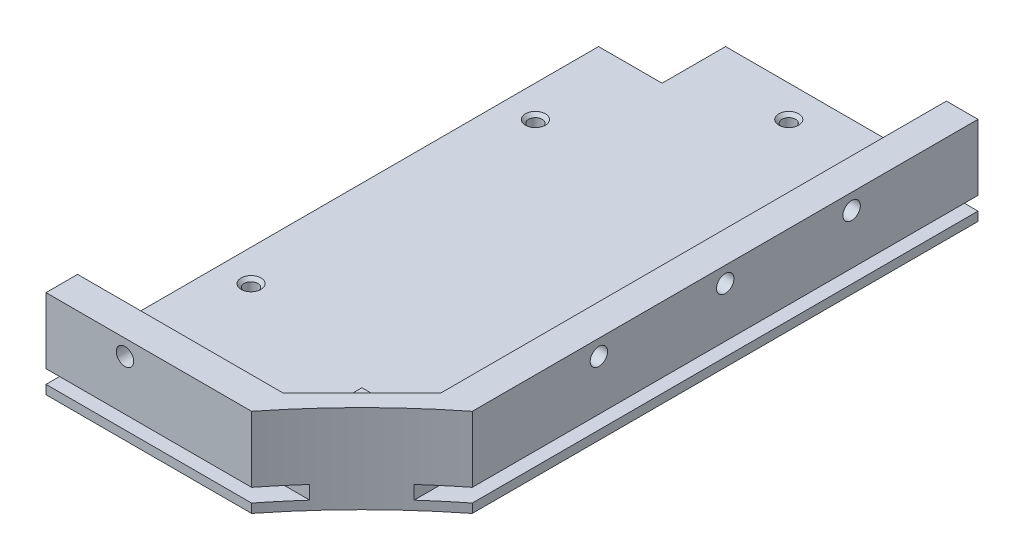
from build123d import *

# Parameters (mm, degrees)
SKETCH1_W                = 650
SKETCH1_H                = 650
BOSS_EXTRUDE1_DEPTH      = 8
BOSS_EXTRUDE2_DEPTH      = 650
CUT_EXTRUDE2_DEPTH       = 921.277302922
CUT_EXTRUDE2_DEPTH_BACK  = 921.277302922
SKETCH4_R                = 11
CUT_EXTRUDE1_DEPTH       = 920.932062709
CUT_EXTRUDE1_DEPTH_BACK  = 920.932062709
SKETCH2_R                = 210
CUT_EXTRUDE3_DEPTH       = 921.277302998
CUT_EXTRUDE3_DEPTH_BACK  = 110
CUT_EXTRUDE4_DEPTH       = 110
CUT_EXTRUDE5_DEPTH       = 920.932062713
CUT_EXTRUDE5_DEPTH_BACK  = 920.932062713
SKETCH7_OUTSIDE_W        = 836.056
SKETCH7_OUTSIDE_H        = 836.056
BOSS_EXTRUDE3_DEPTH      = 160.08
BOSS_EXTRUDE4_DEPTH      = 160.08
SKETCH21_W               = 10
SKETCH21_H               = 4.3
CUT_EXTRUDE10_DEPTH      = 680.197320372
SKETCH22_W               = 10
SKETCH22_H               = 4.3
CUT_EXTRUDE11_DEPTH      = 278.189465889
BOSS_EXTRUDE5_DEPTH      = 60
CUT_EXTRUDE6_DEPTH       = 679.914574891
CUT_EXTRUDE6_DEPTH_BACK  = 679.914574891
SKETCH12_R               = 210
CUT_EXTRUDE14_DEPTH      = 11
SKETCH27_R               = 2.75
CUT_EXTRUDE15_DEPTH      = 11
SKETCH28_R               = 2.75
SKETCH28_R_2             = 2.2
CUT_EXTRUDE16_DEPTH      = 11
SKETCH29_W               = 20
SKETCH29_H               = 20
CUT_EXTRUDE17_DEPTH      = 10
CUT_EXTRUDE18_DEPTH      = 679.914574891
CUT_EXTRUDE18_DEPTH_BACK = 679.914574891
SKETCH30_W               = 95
SKETCH30_H               = 195
CUT_EXTRUDE19_DEPTH      = 679.914574891
CUT_EXTRUDE19_DEPTH_BACK = 679.914574891
SKETCH31_W               = 20.1
SKETCH31_H               = 20.1
SKETCH32_R               = 2.15
CUT_EXTRUDE20_DEPTH      = 10
CHAMFER1_SIZE            = 1


with BuildPart() as part:
    # Sketch1 → Boss-Extrude1 (new body)
    with BuildSketch(Plane(origin=(0, 0, 0), x_dir=(1, 0, 0), z_dir=(0, 1, 0))):
        with Locations((325, 325)):
            Rectangle(SKETCH1_W, SKETCH1_H)
    extrude(amount=BOSS_EXTRUDE1_DEPTH)

    # Sketch3 → Boss-Extrude2 (add)
    with BuildSketch(Plane.XY):
        Polygon((300, 43.707142143), (350, 43.707142143), (385, 8), (265, 8), align=None)
    extrude(amount=-BOSS_EXTRUDE2_DEPTH)

    # Sketch4 → Cut-Extrude2 (cut, two sides: drawn at the far end of the back side and taken through both)
    with BuildSketch(Plane.XY.offset(-CUT_EXTRUDE2_DEPTH_BACK)):
        with Locations((325, 22)):
            Circle(SKETCH4_R)
    extrude(amount=CUT_EXTRUDE2_DEPTH + CUT_EXTRUDE2_DEPTH_BACK, mode=Mode.SUBTRACT)

    # Sketch2 → Cut-Extrude1 (cut, two sides: drawn at the far end of the back side and taken through both)
    with BuildSketch(Plane(origin=(0, 8, 0), x_dir=(1, 0, 0), z_dir=(0, 1, 0)).offset(-CUT_EXTRUDE1_DEPTH_BACK)):
        with Locations(Location((325, 325, 0), (0, 0, 270))):
            Circle(SKETCH2_R)
    extrude(amount=CUT_EXTRUDE1_DEPTH + CUT_EXTRUDE1_DEPTH_BACK, mode=Mode.SUBTRACT)

    # Sketch5 → Cut-Extrude3 (cut, two sides: drawn at the far end of the back side and taken through both)
    with BuildSketch(Plane.XY.offset(-CUT_EXTRUDE3_DEPTH_BACK)):
        Polygon((300, 43.707142143), (350, 43.707142143), (365.396078824, 28), (350, 28), (350, 8), (300, 8), (300, 28), (284.603921176, 28), align=None)
    extrude(amount=CUT_EXTRUDE3_DEPTH + CUT_EXTRUDE3_DEPTH_BACK, mode=Mode.SUBTRACT)

    # Sketch6 → Cut-Extrude4 (cut)
    with BuildSketch(Plane(origin=(0, 0, -650), x_dir=(-1, 0, 0), z_dir=(0, 0, -1))):
        Polygon((-350, 43.707142143), (-300, 43.707142143), (-284.603921176, 28), (-300, 28), (-300, 8), (-350, 8), (-350, 28), (-365.396078824, 28), align=None)
    extrude(amount=-CUT_EXTRUDE4_DEPTH, mode=Mode.SUBTRACT)

    # Sketch7 outside → Cut-Extrude5 (cut, two sides: drawn at the far end of the back side and taken through both)
    with BuildSketch(Plane(origin=(0, 8, 0), x_dir=(1, 0, 0), z_dir=(0, 1, 0)).offset(-CUT_EXTRUDE5_DEPTH_BACK)):
        with Locations((325, 325)):
            Rectangle(SKETCH7_OUTSIDE_W, SKETCH7_OUTSIDE_H)
        Polygon((195, 455), (195, 489.924225025), (195, 650), (167.478198198, 686.544504505), (-70.838918919, 686.544504505), (-70.838918919, 472.462112512), (0, 455), (160.075774975, 455), align=None, mode=Mode.SUBTRACT)
    extrude(amount=CUT_EXTRUDE5_DEPTH + CUT_EXTRUDE5_DEPTH_BACK, mode=Mode.SUBTRACT)

    # Sketch8 → Boss-Extrude3 (add)
    with BuildSketch(Plane(origin=(0, 0, -650), x_dir=(-1, 0, 0), z_dir=(0, 0, -1))):
        Polygon((-195, 8), (-195, 28), (-185, 28), (-185, 17), (-175, 8), align=None)
    extrude(amount=-BOSS_EXTRUDE3_DEPTH)

    # Sketch10 → Boss-Extrude4 (add)
    with BuildSketch(Plane.ZY):
        Polygon((-455, 8), (-455, 28), (-465, 28), (-465, 17), (-475, 8), align=None)
    extrude(amount=-BOSS_EXTRUDE4_DEPTH)

    # Sketch21 → Cut-Extrude10 (cut, through all)
    with BuildSketch(Plane.ZY):
        with Locations((-460, 5)):
            Rectangle(SKETCH21_W, SKETCH21_H)
    extrude(amount=-CUT_EXTRUDE10_DEPTH, mode=Mode.SUBTRACT)

    # Sketch22 → Cut-Extrude11 (cut, through all)
    with BuildSketch(Plane(origin=(0, 0, -650), x_dir=(-1, 0, 0), z_dir=(0, 0, -1))):
        with Locations((-190, 5)):
            Rectangle(SKETCH22_W, SKETCH22_H)
    extrude(amount=-CUT_EXTRUDE11_DEPTH, mode=Mode.SUBTRACT)

    # Sketch23 → Boss-Extrude5 (add)
    with BuildSketch(Plane.XY.offset(-489.92)):
        Polygon((194.99464011, 8), (195, 28), (160.08, 28), (160.08, 8), align=None)
    extrude(amount=BOSS_EXTRUDE5_DEPTH)

    # Sketch12 → Cut-Extrude6 (cut, two sides: drawn at the far end of the back side and taken through both)
    with BuildSketch(Plane(origin=(0, 8, 0), x_dir=(1, 0, 0), z_dir=(0, 1, 0)).offset(-CUT_EXTRUDE6_DEPTH_BACK)):
        with Locations((325, 325)):
            Circle(SKETCH12_R)
    extrude(amount=CUT_EXTRUDE6_DEPTH + CUT_EXTRUDE6_DEPTH_BACK, mode=Mode.SUBTRACT)

    # Sketch26 → Cut-Extrude14 (cut)
    with BuildSketch(Plane(origin=(0, 28, 0), x_dir=(1, 0, 0), z_dir=(0, 1, 0))):
        Polygon((185, 489.92), (160.08, 489.92), (160.08, 465), align=None)
    extrude(amount=-CUT_EXTRUDE14_DEPTH, mode=Mode.SUBTRACT)

    # Sketch27 → Cut-Extrude15 (cut)
    with BuildSketch(Plane.ZY.offset(-185)):
        with Locations((-610, 23)):
            Circle(SKETCH27_R)
        with Locations((-570, 23)):
            Circle(SKETCH27_R)
        with Locations((-530, 23)):
            Circle(SKETCH27_R)
    extrude(amount=-CUT_EXTRUDE15_DEPTH, mode=Mode.SUBTRACT)

    # Sketch28 → Cut-Extrude16 (cut)
    with BuildSketch(Plane(origin=(0, 0, -465), x_dir=(-1, 0, 0), z_dir=(0, 0, -1))):
        with Locations((-120, 23)):
            Circle(SKETCH28_R)
        with Locations((-80, 23)):
            Circle(SKETCH28_R_2)
        with Locations((-40, 23)):
            Circle(SKETCH28_R_2)
    extrude(amount=-CUT_EXTRUDE16_DEPTH, mode=Mode.SUBTRACT)

    # Sketch29 → Cut-Extrude17 (cut)
    with BuildSketch(Plane(origin=(0, 8, 0), x_dir=(1, 0, 0), z_dir=(0, 1, 0))):
        with Locations((10, 640)):
            Rectangle(SKETCH29_W, SKETCH29_H)
    extrude(amount=-CUT_EXTRUDE17_DEPTH, mode=Mode.SUBTRACT)

    # Sketch30 → Cut-Extrude18 (cut, two sides: drawn at the far end of the back side and taken through both)
    with BuildSketch(Plane(origin=(0, 8, 0), x_dir=(1, 0, 0), z_dir=(0, 1, 0)).offset(-CUT_EXTRUDE18_DEPTH_BACK)):
        with Locations((47.5, 552.5)):
            Rectangle(SKETCH30_W, SKETCH30_H)
    extrude(amount=CUT_EXTRUDE18_DEPTH + CUT_EXTRUDE18_DEPTH_BACK, mode=Mode.SUBTRACT)

    # Sketch31 → Cut-Extrude19 (cut, two sides: drawn at the far end of the back side and taken through both)
    with BuildSketch(Plane(origin=(0, 8, 0), x_dir=(1, 0, 0), z_dir=(0, 1, 0)).offset(-CUT_EXTRUDE19_DEPTH_BACK)):
        with Locations((105.05, 639.95)):
            Rectangle(SKETCH31_W, SKETCH31_H)
    extrude(amount=CUT_EXTRUDE19_DEPTH + CUT_EXTRUDE19_DEPTH_BACK, mode=Mode.SUBTRACT)

    # Sketch32 → Cut-Extrude20 (cut)
    with BuildSketch(Plane(origin=(0, 8, 0), x_dir=(1, 0, 0), z_dir=(0, 1, 0))):
        with Locations(Location((105, 599.9, 0), (0, 0, 270))):
            Circle(SKETCH32_R)
        with Locations(Location((105, 509.9, 0), (0, 0, 270))):
            Circle(SKETCH32_R)
        with Locations(Location((145.1, 640, 0), (0, 0, 270))):
            Circle(SKETCH32_R)
    extrude(amount=-CUT_EXTRUDE20_DEPTH, mode=Mode.SUBTRACT)

    # Chamfer1
    chamfer1_edges = [part.edges().sort_by_distance(p)[0] for p in [
        (145.1, 8, -642.15),
        (105, 8, -512.05),
        (105, 8, -602.05),
    ]]
    chamfer(chamfer1_edges, length=CHAMFER1_SIZE)


solid = part.part
